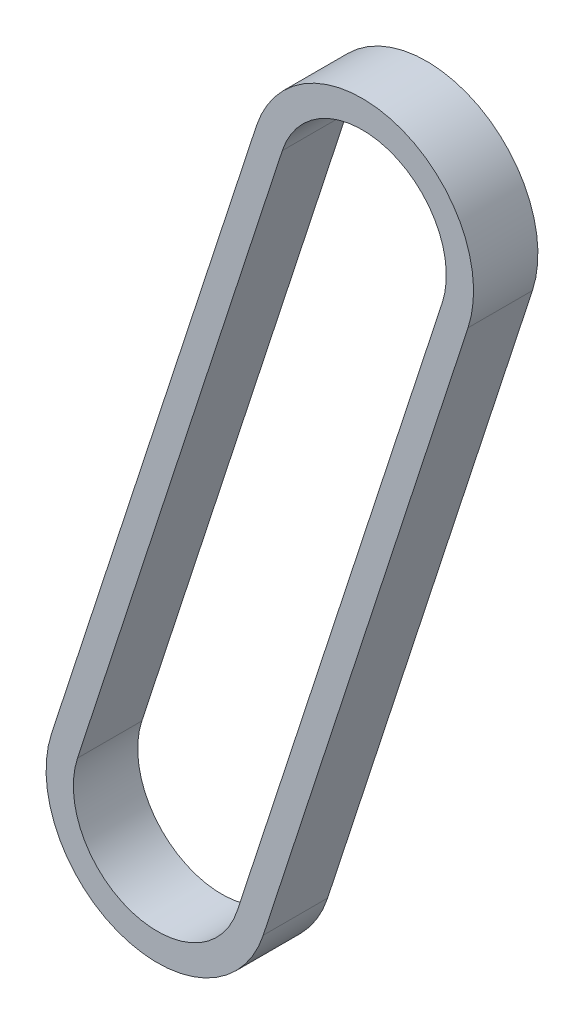
from build123d import *

# Parameters (mm, degrees)
EXTRUDE_THIN1_DEPTH = 4.500000017


with BuildPart() as part:
    # Sketch2 → Extrude-Thin1 (new, symmetric)
    with BuildSketch(Plane.XY):
        with BuildLine():
            Line((43.439644555, 83.064513343), (14.79710314, -4.822408506))
            ThreePointArc((14.79710314, -4.822408506), (-4.822408506, -14.79710314), (-14.79710314, 4.822408506))
            Line((-14.79710314, 4.822408506), (13.845438274, 92.709330355))
            ThreePointArc((13.845438274, 92.709330355), (33.46494992, 102.684024989), (43.439644555, 83.064513343))
        make_face()
        with BuildLine():
            Line((39.817166653, 84.24508687), (11.174625239, -3.641834979))
            ThreePointArc((11.174625239, -3.641834979), (-3.641834979, -11.174625239), (-11.174625239, 3.641834979))
            Line((-11.174625239, 3.641834979), (17.467916175, 91.528756828))
            ThreePointArc((17.467916175, 91.528756828), (32.284376393, 99.061547088), (39.817166653, 84.24508687))
        make_face(mode=Mode.SUBTRACT)
    extrude(amount=EXTRUDE_THIN1_DEPTH, both=True)


solid = part.part
